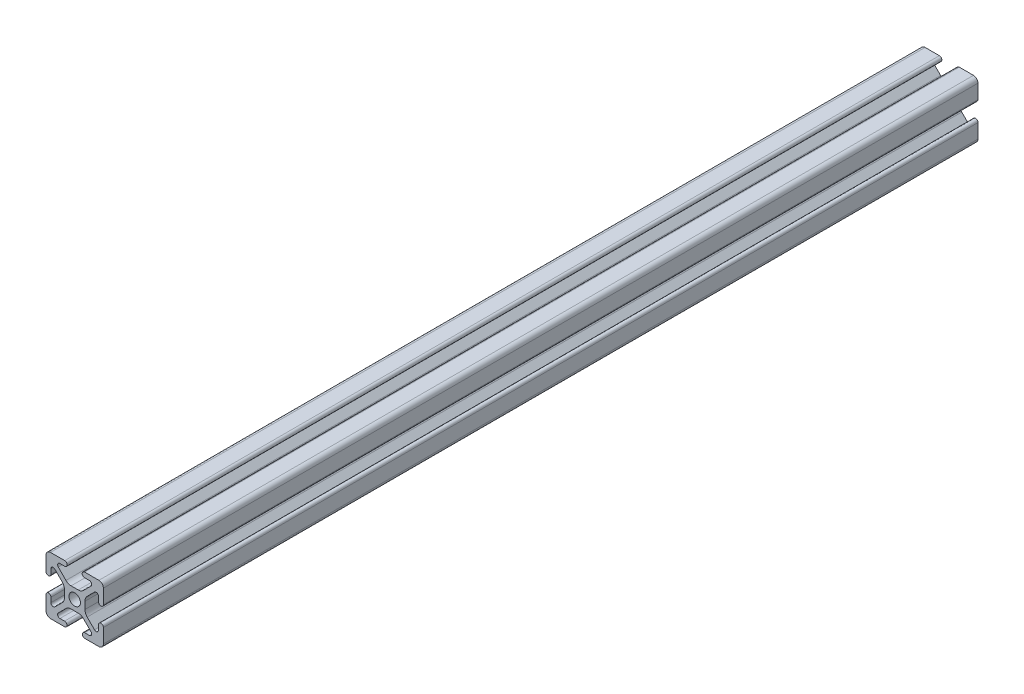
from build123d import *

# Parameters (mm, degrees)
SKETCH1_R           = 2.5
BOSS_EXTRUDE1_DEPTH = 381


with BuildPart() as part:
    # Sketch1 → Boss-Extrude1 (new body)
    with BuildSketch(Plane(origin=(0, 0, -381), x_dir=(-1, 0, 0), z_dir=(0, 0, -1))):
        with BuildLine():
            Line((12.5, 4.32), (12.5, 10.537068835))
            ThreePointArc((12.5, 10.537068835), (11.925070773, 11.925070773), (10.537068835, 12.5))
            Line((10.537068835, 12.5), (4.32, 12.5))
            ThreePointArc((4.32, 12.5), (3.25, 11.43), (4.32, 10.36))
            Line((4.32, 10.36), (6.42, 10.36))
            ThreePointArc((6.42, 10.36), (7.35325999, 9.736168088), (7.133653912, 8.635298598))
            Line((7.133653912, 8.635298598), (3.795290766, 5.301828272))
            ThreePointArc((3.795290766, 5.301828272), (2.76743922, 4.61585726), (1.555406707, 4.375))
            Line((1.555406707, 4.375), (-1.555406707, 4.375))
            ThreePointArc((-1.555406707, 4.375), (-2.76743922, 4.61585726), (-3.795290766, 5.301828272))
            Line((-3.795290766, 5.301828272), (-7.133653912, 8.635298598))
            ThreePointArc((-7.133653912, 8.635298598), (-7.35325999, 9.736168088), (-6.42, 10.36))
            Line((-6.42, 10.36), (-4.32, 10.36))
            ThreePointArc((-4.32, 10.36), (-3.25, 11.43), (-4.32, 12.5))
            Line((-4.32, 12.5), (-10.537068835, 12.5))
            ThreePointArc((-10.537068835, 12.5), (-11.925070773, 11.925070773), (-12.5, 10.537068835))
            Line((-12.5, 10.537068835), (-12.5, 4.32))
            ThreePointArc((-12.5, 4.32), (-11.43, 3.25), (-10.36, 4.32))
            Line((-10.36, 4.32), (-10.36, 6.396886949))
            ThreePointArc((-10.36, 6.396886949), (-9.736852394, 7.329863489), (-8.636346088, 7.111588351))
            Line((-8.636346088, 7.111588351), (-5.432204773, 3.912143135))
            ThreePointArc((-5.432204773, 3.912143135), (-4.708985779, 2.831057106), (-4.455, 1.555406707))
            Line((-4.455, 1.555406707), (-4.455, -1.555406707))
            ThreePointArc((-4.455, -1.555406707), (-4.708985779, -2.831057106), (-5.432204773, -3.912143135))
            Line((-5.432204773, -3.912143135), (-8.636346088, -7.111588351))
            ThreePointArc((-8.636346088, -7.111588351), (-9.736852394, -7.329863489), (-10.36, -6.396886949))
            Line((-10.36, -6.396886949), (-10.36, -4.32))
            ThreePointArc((-10.36, -4.32), (-11.43, -3.25), (-12.5, -4.32))
            Line((-12.5, -4.32), (-12.5, -10.537068835))
            ThreePointArc((-12.5, -10.537068835), (-11.925070773, -11.925070773), (-10.537068835, -12.5))
            Line((-10.537068835, -12.5), (-4.387856959, -12.5))
            ThreePointArc((-4.387856959, -12.5), (-3.317856959, -11.43), (-4.387856959, -10.36))
            Line((-4.387856959, -10.36), (-6.42, -10.36))
            ThreePointArc((-6.42, -10.36), (-7.35325999, -9.736168088), (-7.133653912, -8.635298598))
            Line((-7.133653912, -8.635298598), (-3.795290766, -5.301828272))
            ThreePointArc((-3.795290766, -5.301828272), (-2.76743922, -4.61585726), (-1.555406707, -4.375))
            Line((-1.555406707, -4.375), (1.555406707, -4.375))
            ThreePointArc((1.555406707, -4.375), (2.76743922, -4.61585726), (3.795290766, -5.301828272))
            Line((3.795290766, -5.301828272), (7.133653912, -8.635298598))
            ThreePointArc((7.133653912, -8.635298598), (7.35325999, -9.736168088), (6.42, -10.36))
            Line((6.42, -10.36), (4.387856959, -10.36))
            ThreePointArc((4.387856959, -10.36), (3.317856959, -11.43), (4.387856959, -12.5))
            Line((4.387856959, -12.5), (10.537068835, -12.5))
            ThreePointArc((10.537068835, -12.5), (11.925070773, -11.925070773), (12.5, -10.537068835))
            Line((12.5, -10.537068835), (12.5, -4.32))
            ThreePointArc((12.5, -4.32), (11.43, -3.25), (10.36, -4.32))
            Line((10.36, -4.32), (10.36, -6.396886949))
            ThreePointArc((10.36, -6.396886949), (9.736852394, -7.329863489), (8.636346088, -7.111588351))
            Line((8.636346088, -7.111588351), (5.432204773, -3.912143135))
            ThreePointArc((5.432204773, -3.912143135), (4.708985779, -2.831057106), (4.455, -1.555406707))
            Line((4.455, -1.555406707), (4.455, 1.555406707))
            ThreePointArc((4.455, 1.555406707), (4.708985779, 2.831057106), (5.432204773, 3.912143135))
            Line((5.432204773, 3.912143135), (8.636346088, 7.111588351))
            ThreePointArc((8.636346088, 7.111588351), (9.736852394, 7.329863489), (10.36, 6.396886949))
            Line((10.36, 6.396886949), (10.36, 4.32))
            ThreePointArc((10.36, 4.32), (11.43, 3.25), (12.5, 4.32))
        make_face()
        with Locations(Location((0, 0, 0), (0, 0, 180))):
            Circle(SKETCH1_R, mode=Mode.SUBTRACT)
    extrude(amount=-BOSS_EXTRUDE1_DEPTH)


solid = part.part
